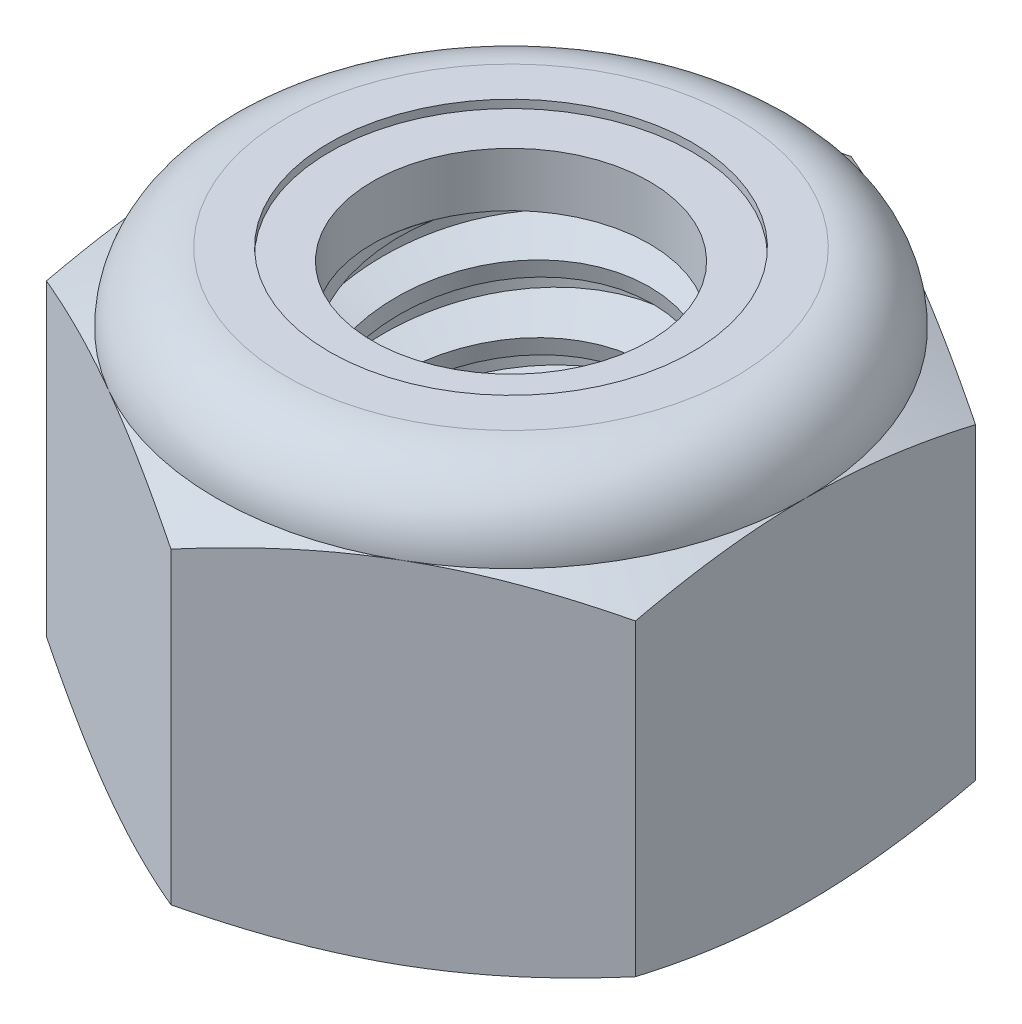
from build123d import *

# Parameters (mm, degrees)
EXTRUDE1_DEPTH      = 7.9375
SKETCH2_W           = 3.175
SKETCH2_H           = 7.9375
LPATTERN1_COUNT     = 6
LPATTERN1_PITCH     = 1.27
LPATTERN1_COL_COUNT = 2
LPATTERN1_COL_PITCH = 1.27


with BuildPart() as part:
    # Sketch1 → Extrude1 (new body)
    with BuildSketch(Plane(origin=(0, 0, 0), x_dir=(1, 0, 0), z_dir=(0, 1, 0))):
        Polygon((0, 6.415804866), (-5.55625, 3.207902433), (-5.55625, -3.207902433), (0, -6.415804866), (5.55625, -3.207902433), (5.55625, 3.207902433), align=None)
    extrude(amount=EXTRUDE1_DEPTH)

    # Sketch4 → Cut-Revolve2 (revolve, cut)
    with BuildSketch(Plane(origin=(0, 0, 0), x_dir=(0, 0, -1), z_dir=(1, 0, 0)), mode=Mode.PRIVATE) as cut_revolve2_sk:
        Polygon((0, 7.9375), (3.175, 7.9375), (2.609908356, 7.673993439), (2.609908356, 0.263506561), (3.175, 0), (0, 0), align=None)
    revolve(cut_revolve2_sk.sketch.rotate(Axis((0, 7.9375, 0), (0, 1, 0)), 54.49881281), axis=Axis((0, 7.9375, 0), (0, 1, 0)), mode=Mode.SUBTRACT)


with BuildPart() as body_2:
    # Sketch2 → Revolve1 (revolve)
    with BuildSketch(Plane(origin=(0, 0, 0), x_dir=(0, 0, -1), z_dir=(1, 0, 0))):
        with Locations((1.5875, 3.96875)):
            Rectangle(SKETCH2_W, SKETCH2_H)
    revolve(axis=Axis((0, -3.175, 0), (0, 1, 0)))

    # Sketch3 → Cut-Revolve1 (revolve, cut)
    with BuildSketch(Plane(origin=(0, 0, 0), x_dir=(0, 0, -1), z_dir=(1, 0, 0)), mode=Mode.PRIVATE) as cut_revolve1_sk:
        Polygon((3.206133436, 7.781832818), (3.424067492, 6.692162542), (2.672175229, 6.946518763), (2.609908356, 7.257853128), align=None)
    cut_revolve1 = revolve(cut_revolve1_sk.sketch.rotate(Axis((0, 7.9375, 0.272704483), (0, -0.9805806756909202, -0.19611613513818404)), 180), axis=Axis((0, 7.9375, 0.272704483), (0, -0.9805806756909202, -0.19611613513818404)), mode=Mode.SUBTRACT)

    # LPattern1: Cut-Revolve1 ×6
    with Locations(*[(0, -i * LPATTERN1_PITCH, 0) for i in range(1, LPATTERN1_COUNT)]):
        add(cut_revolve1, mode=Mode.SUBTRACT)

    # LPattern1 col: Cut-Revolve1 ×2
    with Locations(*[(0, i * LPATTERN1_COL_PITCH, 0) for i in range(1, LPATTERN1_COL_COUNT)]):
        add(cut_revolve1, mode=Mode.SUBTRACT)


with BuildPart() as part_1:
    add(part.part)

    # Combine1: cut body 2
    add(body_2.part, mode=Mode.SUBTRACT)

    # Sketch5 → Cut-Revolve3 (revolve, cut)
    with BuildSketch(Plane(origin=(0, 0, 0), x_dir=(0, 0, -1), z_dir=(1, 0, 0)), mode=Mode.PRIVATE) as cut_revolve3_sk:
        with BuildLine():
            Line((0, 0), (5.55625, 0))
            Line((5.55625, 0), (6.415804866, 0.400817017))
            Line((6.415804866, 0.400817017), (6.415804866, 6.213766317))
            Line((6.415804866, 6.213766317), (5.55625, 6.614583333))
            ThreePointArc((5.55625, 6.614583333), (5.168776679, 7.550026679), (4.233333333, 7.9375))
            Line((4.233333333, 7.9375), (4.233333333, 9.2075))
            Line((4.233333333, 9.2075), (7.685804866, 9.2075))
            Line((7.685804866, 9.2075), (7.685804866, -1.27))
            Line((7.685804866, -1.27), (0, -1.27))
            Line((0, -1.27), (0, 0))
        make_face()
    revolve(cut_revolve3_sk.sketch.rotate(Axis((0, 0, 0), (0, 1, 0)), 54.619043446), axis=Axis((0, 0, 0), (0, 1, 0)), mode=Mode.SUBTRACT)

    # Sketch6 → Cut-Revolve4 (revolve, cut)
    with BuildSketch(Plane(origin=(0, 0, 0), x_dir=(0, 0, -1), z_dir=(1, 0, 0)), mode=Mode.PRIVATE) as cut_revolve4_sk:
        with BuildLine():
            Line((0, 6.614583333), (5.40385, 6.614583333))
            ThreePointArc((5.40385, 6.614583333), (5.061013606, 7.442263606), (4.233333333, 7.7851))
            Line((4.233333333, 7.7851), (3.421620845, 7.7851))
            Line((3.421620845, 7.7851), (3.421620845, 9.2075))
            Line((3.421620845, 9.2075), (0, 9.2075))
            Line((0, 9.2075), (0, 6.614583333))
        make_face()
    revolve(cut_revolve4_sk.sketch.rotate(Axis((0, 9.2075, 0), (0, 1, 0)), 54.49881281), axis=Axis((0, 9.2075, 0), (0, 1, 0)), mode=Mode.SUBTRACT)


with BuildPart() as body_2_2:
    # Sketch7 → Revolve2 (revolve)
    with BuildSketch(Plane(origin=(0, 0, 0), x_dir=(0, 0, -1), z_dir=(1, 0, 0))):
        with BuildLine():
            Line((2.609908356, 6.690783333), (5.324993778, 6.690783333))
            ThreePointArc((5.324993778, 6.690783333), (4.979705237, 7.4148695), (4.233333333, 7.7089))
            Line((4.233333333, 7.7089), (2.609908356, 7.7089))
            Line((2.609908356, 7.7089), (2.609908356, 6.690783333))
        make_face()
    revolve(axis=Axis((0, 6.690783333, 0), (0, 1, 0)))


solid = Compound([part_1.part, body_2_2.part])
